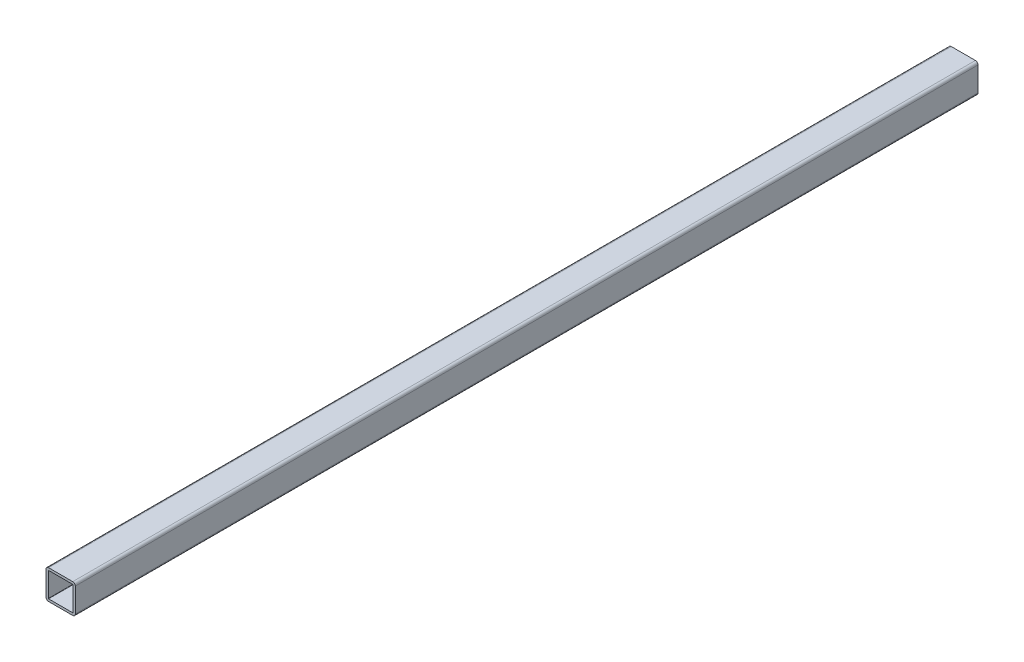
from build123d import *

# Parameters (mm, degrees)
STRUCTURAL_MEMBER1_DEPTH = 770


with BuildPart() as part:
    # Sketch11 → Structural Member1 (new body)
    with BuildSketch(Plane(origin=(0, 0, 0), x_dir=(-1, 0, 0), z_dir=(0, 0, -1))):
        with BuildLine():
            Line((-10.3, -12.5), (10.3, -12.5))
            ThreePointArc((10.3, -12.5), (11.855634919, -11.855634919), (12.5, -10.3))
            Line((12.5, -10.3), (12.5, 10.3))
            ThreePointArc((12.5, 10.3), (11.855634919, 11.855634919), (10.3, 12.5))
            Line((10.3, 12.5), (-10.3, 12.5))
            ThreePointArc((-10.3, 12.5), (-11.855634919, 11.855634919), (-12.5, 10.3))
            Line((-12.5, 10.3), (-12.5, -10.3))
            ThreePointArc((-12.5, -10.3), (-11.855634919, -11.855634919), (-10.3, -12.5))
        make_face()
        with BuildLine():
            Line((-10.3, -10.5), (10.3, -10.5))
            ThreePointArc((10.3, -10.5), (10.441421356, -10.441421356), (10.5, -10.3))
            Line((10.5, -10.3), (10.5, 10.3))
            ThreePointArc((10.5, 10.3), (10.441421356, 10.441421356), (10.3, 10.5))
            Line((10.3, 10.5), (-10.3, 10.5))
            ThreePointArc((-10.3, 10.5), (-10.441421356, 10.441421356), (-10.5, 10.3))
            Line((-10.5, 10.3), (-10.5, -10.3))
            ThreePointArc((-10.5, -10.3), (-10.441421356, -10.441421356), (-10.3, -10.5))
        make_face(mode=Mode.SUBTRACT)
    extrude(amount=STRUCTURAL_MEMBER1_DEPTH)


solid = part.part
